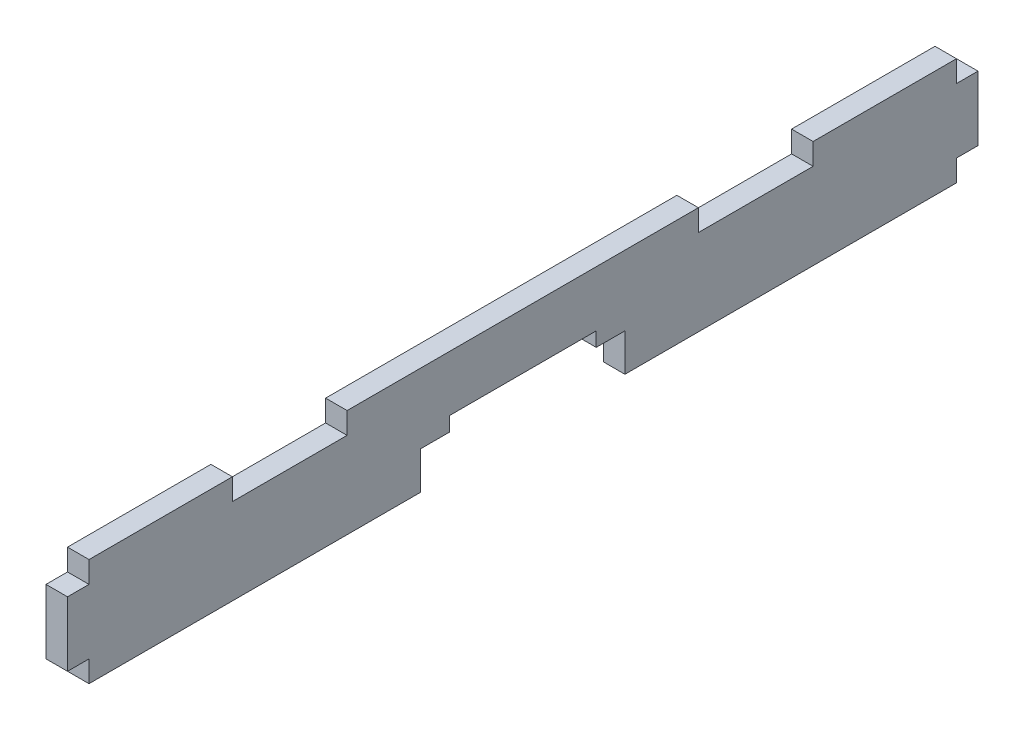
from build123d import *

# Parameters (mm, degrees)
BOSS_EXTRUDE1_DEPTH = 3


with BuildPart() as part:
    # Sketch1 → Boss-Extrude1 (new body)
    with BuildSketch(Plane(origin=(0, 0, 0), x_dir=(0, 0, -1), z_dir=(1, 0, 0))):
        Polygon((0, 3), (0, 0), (46.25, 0), (46.25, 5.25), (50.25, 5.25), (50.25, 7.25), (70.75, 7.25), (70.75, 5.25), (74.75, 5.25), (74.75, 0), (121, 0), (121, 3), (124, 3), (124, 12), (121, 12), (121, 15), (101, 15), (101, 12), (85, 12), (85, 15), (36, 15), (36, 12), (20, 12), (20, 15), (0, 15), (0, 12), (-3, 12), (-3, 3), align=None)
    extrude(amount=BOSS_EXTRUDE1_DEPTH)


solid = part.part
